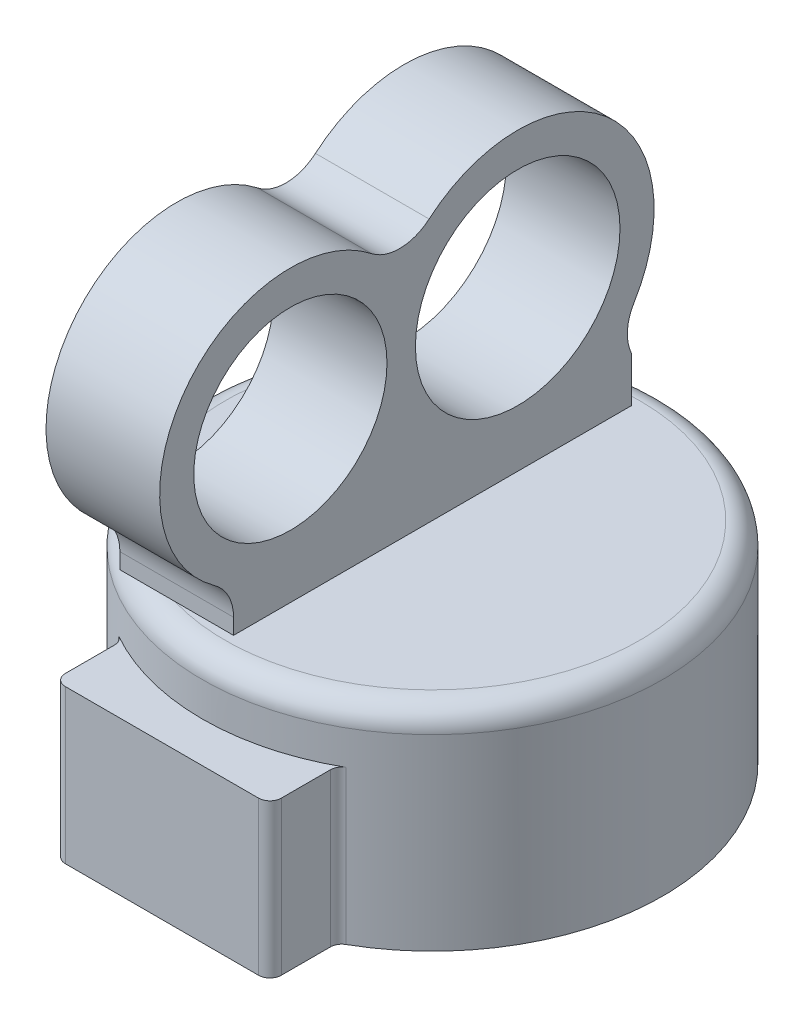
from build123d import *

# Parameters (mm, degrees)
BOSS_EXTRUDE1_DEPTH = 13.5
SKETCH2_R           = 20.25
BOSS_EXTRUDE2_DEPTH = 5
FILLET1_R           = 2
SKETCH3_R           = 9
SKETCH3_R_2         = 8.5
BOSS_EXTRUDE3_DEPTH = 10


with BuildPart() as part:
    # Sketch1 → Boss-Extrude1 (new body)
    with BuildSketch(Plane(origin=(0, 0, 0), x_dir=(1, 0, 0), z_dir=(0, 1, 0))):
        with BuildLine():
            Line((-9.5, -18.474644787), (-9.5, -22.8))
            ThreePointArc((-9.5, -22.8), (-9.207106781, -23.507106781), (-8.5, -23.8))
            Line((-8.5, -23.8), (8.5, -23.8))
            ThreePointArc((8.5, -23.8), (9.207106781, -23.507106781), (9.5, -22.8))
            Line((9.5, -22.8), (9.5, -18.474644787))
            ThreePointArc((9.5, -18.474644787), (9.635674353, -17.97171221), (10.005882353, -17.605249738))
            ThreePointArc((10.005882353, -17.605249738), (0, 20.25), (-10.005882353, -17.605249738))
            ThreePointArc((-10.005882353, -17.605249738), (-9.635674353, -17.97171221), (-9.5, -18.474644787))
        make_face()
    extrude(amount=BOSS_EXTRUDE1_DEPTH)

    # Sketch2 → Boss-Extrude2 (add)
    with BuildSketch(Plane(origin=(0, 13.5, 0), x_dir=(1, 0, 0), z_dir=(0, 1, 0))):
        with Locations(Location((0, 0, 0), (0, 0, 90))):
            Circle(SKETCH2_R)
    extrude(amount=BOSS_EXTRUDE2_DEPTH)

    # Fillet1
    fillet1_edges = [part.edges().sort_by_distance(p)[0] for p in [
        (0, 18.5, 20.25),
    ]]
    fillet(fillet1_edges, radius=FILLET1_R)

    # Sketch3 → Boss-Extrude3 (add)
    with BuildSketch(Plane(origin=(0, 0, 0), x_dir=(0, 0, -1), z_dir=(1, 0, 0))):
        with BuildLine():
            Line((17.5, 18.5), (17.5, 22.5))
            ThreePointArc((17.5, 22.5), (17.153602274, 24.396242961), (17.734313483, 26.234313483))
            ThreePointArc((17.734313483, 26.234313483), (15.290492633, 41.627333923), (-0.2953125, 41.6232178))
            ThreePointArc((-0.2953125, 41.6232178), (-2.816482529, 40.665036752), (-5.372782258, 41.525118684))
            ThreePointArc((-5.372782258, 41.525118684), (-21.696710883, 39.404383313), (-19.177419355, 23.137197494))
            ThreePointArc((-19.177419355, 23.137197494), (-17.943996444, 21.712192415), (-17.5, 19.880570536))
            Line((-17.5, 19.880570536), (-17.5, 18.5))
            Line((-17.5, 18.5), (17.5, 18.5))
        make_face()
        with Locations((7.5, 32.5)):
            Circle(SKETCH3_R, mode=Mode.SUBTRACT)
        with Locations((-12.5, 32.5)):
            Circle(SKETCH3_R_2, mode=Mode.SUBTRACT)
    extrude(amount=-BOSS_EXTRUDE3_DEPTH)


solid = part.part
